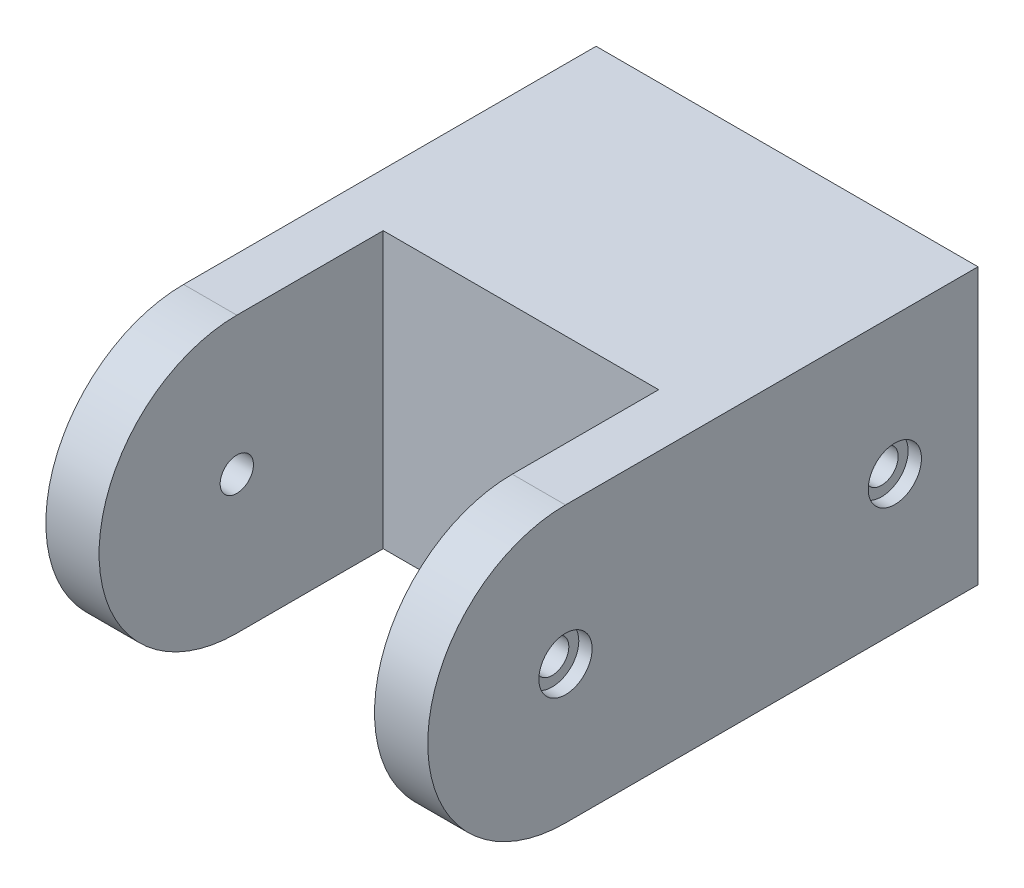
from build123d import *

# Parameters (mm, degrees)
SKETCH1_W           = 57.4
SKETCH1_H           = 41.4
SKETCH1_W_2         = 25.4
SKETCH1_H_2         = 25.4
BOSS_EXTRUDE1_DEPTH = 30
SKETCH2_W           = 57.4
SKETCH2_H           = 41.4
BOSS_EXTRUDE2_DEPTH = 10
BOSS_EXTRUDE3_DEPTH = 8
BOSS_EXTRUDE4_START = -8
BOSS_EXTRUDE4_DEPTH = 8
CUT_EXTRUDE1_REACH  = 104.774
SKETCH6_R           = 2.5
CUT_EXTRUDE4_REACH  = 104.774
SKETCH9_R           = 2.5
SKETCH7_R           = 4
CUT_EXTRUDE2_DEPTH  = 2
CUT_EXTRUDE3_START  = -2
SKETCH8_R           = 4
CUT_EXTRUDE3_DEPTH  = 2


with BuildPart() as part:
    # Sketch1 → Boss-Extrude1 (new body)
    with BuildSketch(Plane.XY):
        Rectangle(SKETCH1_W, SKETCH1_H)
        Rectangle(SKETCH1_W_2, SKETCH1_H_2, mode=Mode.SUBTRACT)
    extrude(amount=BOSS_EXTRUDE1_DEPTH)

    # Sketch2 → Boss-Extrude2 (add)
    with BuildSketch(Plane.XY.offset(30)):
        Rectangle(SKETCH2_W, SKETCH2_H)
    extrude(amount=BOSS_EXTRUDE2_DEPTH)

    # Sketch4 → Boss-Extrude3 (add)
    with BuildSketch(Plane(origin=(28.7, 0, 0), x_dir=(0, 0, -1), z_dir=(1, 0, 0))):
        with BuildLine():
            Line((-40, -20.7), (-40, 20.7))
            Line((-40, 20.7), (-62, 20.7))
            ThreePointArc((-62, 20.7), (-82.7, 0), (-62, -20.7))
            Line((-62, -20.7), (-40, -20.7))
        make_face()
    extrude(amount=-BOSS_EXTRUDE3_DEPTH)

    # Sketch5 → Boss-Extrude4 (add)
    with BuildSketch(Plane.ZY.offset(28.7).offset(BOSS_EXTRUDE4_START)):
        with BuildLine():
            Line((40, 20.7), (40, -20.7))
            Line((40, -20.7), (62, -20.7))
            ThreePointArc((62, -20.7), (82.7, 0), (62, 20.7))
            Line((62, 20.7), (40, 20.7))
        make_face()
    extrude(amount=BOSS_EXTRUDE4_DEPTH)

    # Cut-Extrude1: up to this face of the body (flat: up to its plane)
    cut_extrude1_end = Plane(part.part.faces().sort_by_distance((-28.7, 0, 39.26525255))[0])
    # Sketch6 → Cut-Extrude1 (cut, up to the picked face)
    with BuildSketch(Plane(origin=(28.7, 0, 0), x_dir=(0, 0, -1), z_dir=(1, 0, 0)), mode=Mode.PRIVATE) as cut_extrude1_sk1:
        with Locations((-62, 0)):
            Circle(SKETCH6_R)
    cut_extrude1_tool1 = split(extrude(cut_extrude1_sk1.sketch, amount=-CUT_EXTRUDE1_REACH, mode=Mode.PRIVATE), bisect_by=cut_extrude1_end, keep=Keep.BOTH, mode=Mode.PRIVATE)
    add(cut_extrude1_tool1.solids().sort_by(Axis((28.7, 0, 62), (-1, 0, 0)))[0], mode=Mode.SUBTRACT)

    # Cut-Extrude4: up to this face of the body (flat: up to its plane)
    cut_extrude4_end = Plane(part.part.faces().sort_by_distance((-28.7, 0, 39.126630479))[0])
    # Sketch9 → Cut-Extrude4 (cut, up to the picked face)
    with BuildSketch(Plane(origin=(28.7, 0, 0), x_dir=(0, 0, -1), z_dir=(1, 0, 0)), mode=Mode.PRIVATE) as cut_extrude4_sk1:
        with Locations((-12.5, 0)):
            Circle(SKETCH9_R)
    cut_extrude4_tool1 = split(extrude(cut_extrude4_sk1.sketch, amount=-CUT_EXTRUDE4_REACH, mode=Mode.PRIVATE), bisect_by=cut_extrude4_end, keep=Keep.BOTH, mode=Mode.PRIVATE)
    add(cut_extrude4_tool1.solids().sort_by(Axis((28.7, 0, 12.5), (-1, 0, 0)))[0], mode=Mode.SUBTRACT)

    # Sketch7 → Cut-Extrude2 (cut)
    with BuildSketch(Plane.ZY.offset(28.7)):
        with Locations((62, 0)):
            Circle(SKETCH7_R)
        with Locations((12.5, 0)):
            Circle(SKETCH7_R)
    extrude(amount=-CUT_EXTRUDE2_DEPTH, mode=Mode.SUBTRACT)

    # Sketch8 → Cut-Extrude3 (cut)
    with BuildSketch(Plane(origin=(28.7, 0, 0), x_dir=(0, 0, -1), z_dir=(1, 0, 0)).offset(CUT_EXTRUDE3_START)):
        with Locations(Location((-62, 0, 0), (0, 0, 180))):
            Circle(SKETCH8_R)
        with Locations(Location((-12.5, 0, 0), (0, 0, 180))):
            Circle(SKETCH8_R)
    extrude(amount=CUT_EXTRUDE3_DEPTH, mode=Mode.SUBTRACT)


solid = part.part
